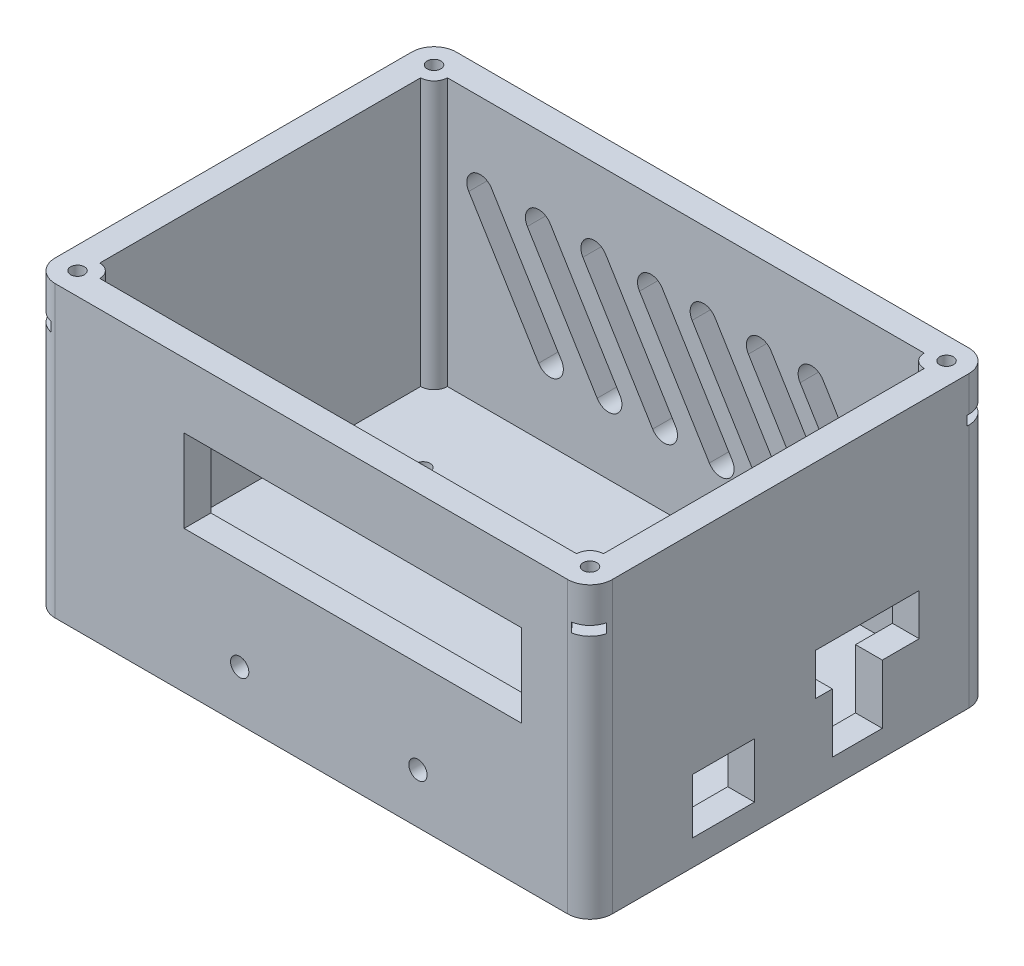
from build123d import *

# Parameters (mm, degrees)
SKETCH1_W           = 125
SKETCH1_H           = 90
BOSS_EXTRUDE1_DEPTH = 5
SKETCH2_W           = 125
SKETCH2_H           = 90
SKETCH2_W_2         = 113
SKETCH2_H_2         = 78
EXTRUDE_THIN1_DEPTH = 60
FILLET1_R           = 5
CUT_EXTRUDE12_REACH = 125.237
SKETCH17_R          = 2.05
CUT_EXTRUDE13_DEPTH = 3
CUT_EXTRUDE15_REACH = 129.402
SKETCH14_W          = 75.736486469
SKETCH14_H          = 18.550578115
SKETCH20_R          = 3
BOSS_EXTRUDE2_DEPTH = 60
SKETCH21_R          = 1.55
CUT_EXTRUDE16_DEPTH = 15
CUT_EXTRUDE17_DEPTH = 2.1
CUT_EXTRUDE18_REACH = 129.402
CUT_EXTRUDE19_REACH = 149.902
SKETCH26_W          = 13.905528105
SKETCH26_H          = 12.333109577
CUT_EXTRUDE20_REACH = 99.628
SKETCH27_R          = 1.5875


with BuildPart() as part:
    # Sketch1 → Boss-Extrude1 (new body)
    with BuildSketch(Plane(origin=(0, 0, 0), x_dir=(1, 0, 0), z_dir=(0, 1, 0))):
        Rectangle(SKETCH1_W, SKETCH1_H)
    extrude(amount=BOSS_EXTRUDE1_DEPTH)

    # Sketch2 → Extrude-Thin1 (add)
    with BuildSketch(Plane(origin=(0, 5, 0), x_dir=(1, 0, 0), z_dir=(0, 1, 0))):
        Rectangle(SKETCH2_W, SKETCH2_H)
        Rectangle(SKETCH2_W_2, SKETCH2_H_2, mode=Mode.SUBTRACT)
    extrude(amount=EXTRUDE_THIN1_DEPTH)

    # Fillet1
    fillet1_edges = [part.edges().sort_by_distance(p)[0] for p in [
        (-62.5, 32.5, -45),
        (62.5, 32.5, -45),
        (62.5, 32.5, 45),
        (-62.5, 32.5, 45),
    ]]
    fillet(fillet1_edges, radius=FILLET1_R)

    # Sketch17 → Cut-Extrude12 (cut, up to next)
    with BuildSketch(Plane(origin=(0, 0, 39), x_dir=(-1, 0, 0), z_dir=(0, 0, -1)), mode=Mode.PRIVATE) as cut_extrude12_sk1:
        with Locations((-23.894791756, 11.205792227)):
            Circle(SKETCH17_R)
    cut_extrude12_tool1 = extrude(cut_extrude12_sk1.sketch, amount=-CUT_EXTRUDE12_REACH, mode=Mode.PRIVATE) & part.part
    # Sketch17 → Cut-Extrude12 (cut, up to next)
    with BuildSketch(Plane(origin=(0, 0, 39), x_dir=(-1, 0, 0), z_dir=(0, 0, -1)), mode=Mode.PRIVATE) as cut_extrude12_sk2:
        with Locations((16.105208244, 11.205792227)):
            Circle(SKETCH17_R)
    cut_extrude12_tool2 = extrude(cut_extrude12_sk2.sketch, amount=-CUT_EXTRUDE12_REACH, mode=Mode.PRIVATE) & part.part
    add(cut_extrude12_tool1.solids().sort_by_distance((23.894792, 11.205792, 39))[0], mode=Mode.SUBTRACT)
    add(cut_extrude12_tool2.solids().sort_by_distance((-16.105208, 11.205792, 39))[0], mode=Mode.SUBTRACT)

    # Sketch18 → Cut-Extrude13 (cut)
    with BuildSketch(Plane(origin=(0, 0, 39), x_dir=(-1, 0, 0), z_dir=(0, 0, -1))):
        Polygon((-21.92132986, 7.547179355), (-19.739609119, 11.085553926), (-21.713071015, 14.744166798), (-25.868253652, 14.864405099), (-28.049974394, 11.326030527), (-26.076512498, 7.667417656), align=None)
        Polygon((18.07867014, 7.547179355), (20.260390881, 11.085553926), (18.286928985, 14.744166798), (14.131746348, 14.864405099), (11.950025606, 11.326030527), (13.923487502, 7.667417656), align=None)
    extrude(amount=-CUT_EXTRUDE13_DEPTH, mode=Mode.SUBTRACT)

    # Sketch14 → Cut-Extrude15 (cut, up to next)
    with BuildSketch(Plane.XY.offset(45), mode=Mode.PRIVATE) as cut_extrude15_sk1:
        with Locations((9.294573428, 41.162886515)):
            Rectangle(SKETCH14_W, SKETCH14_H)
    cut_extrude15_tool1 = extrude(cut_extrude15_sk1.sketch, amount=-CUT_EXTRUDE15_REACH, mode=Mode.PRIVATE) & part.part
    add(cut_extrude15_tool1.solids().sort_by_distance((9.294573, 41.162887, 45))[0], mode=Mode.SUBTRACT)

    # Sketch20 → Boss-Extrude2 (add)
    with BuildSketch(Plane(origin=(0, 5, 0), x_dir=(1, 0, 0), z_dir=(0, 1, 0))):
        with Locations((-56.5, -39)):
            Circle(SKETCH20_R)
        with Locations((-56.5, 39)):
            Circle(SKETCH20_R)
        with Locations((56.5, 39)):
            Circle(SKETCH20_R)
        with Locations((56.5, -39)):
            Circle(SKETCH20_R)
    extrude(amount=BOSS_EXTRUDE2_DEPTH)

    # Sketch21 → Cut-Extrude16 (cut)
    with BuildSketch(Plane(origin=(0, 65, 0), x_dir=(1, 0, 0), z_dir=(0, 1, 0))):
        with Locations(Location((-57.5, -40, 0), (0, 0, 270))):
            Circle(SKETCH21_R)
        with Locations(Location((-57.5, 40, 0), (0, 0, 270))):
            Circle(SKETCH21_R)
        with Locations(Location((57.5, 40, 0), (0, 0, 270))):
            Circle(SKETCH21_R)
        with Locations(Location((57.5, -40, 0), (0, 0, 270))):
            Circle(SKETCH21_R)
    extrude(amount=-CUT_EXTRUDE16_DEPTH, mode=Mode.SUBTRACT)

    # Sketch22 → Cut-Extrude17 (cut)
    with BuildSketch(Plane(origin=(0, 55, 0), x_dir=(1, 0, 0), z_dir=(0, 1, 0))):
        Polygon((-56.858335649, 43.168848402), (-60.369838633, 46.269790836), (-64.01667189, 42.140121829), (-60.565135392, 38.971273428), (-58.141664351, 36.831151598), (-55.076528959, 37.859878171), (-54.434864608, 41.028726572), align=None)
        Polygon((57.5, 43.233161507), (54.7, 41.616580754), (54.7, 38.383419246), (57.5, 36.766838493), (60.3, 38.383419246), (64.375727021, 40.73252086), (61.573986103, 45.585278481), align=None)
        Polygon((60.65032729, -39.272833374), (58.445418874, -36.908153224), (55.295091585, -37.63531985), (54.34967271, -40.727166626), (56.554581126, -43.091846776), (59.704908415, -46.470452598), (63.774744064, -42.675599045), align=None)
        Polygon((-54.378247252, -40.841423267), (-55.210429701, -37.71719445), (-58.332182449, -36.875771182), (-60.621752748, -39.158576733), (-64.278002246, -42.804023501), (-60.369838633, -46.723768365), (-56.667817551, -43.124228818), align=None)
    extrude(amount=CUT_EXTRUDE17_DEPTH, mode=Mode.SUBTRACT)

    # Sketch23 → Cut-Extrude18 (cut, up to next)
    with BuildSketch(Plane(origin=(0, 0, -45), x_dir=(-1, 0, 0), z_dir=(0, 0, -1)), mode=Mode.PRIVATE) as cut_extrude18_sk1:
        with BuildLine():
            Line((-25.648371423, 45.311645428), (-41.315651552, 19.761127033))
            ThreePointArc((-41.315651552, 19.761127033), (-45.441346582, 18.771864422), (-46.430609193, 22.897559452))
            Line((-46.430609193, 22.897559452), (-30.763329065, 48.448077847))
            ThreePointArc((-30.763329065, 48.448077847), (-26.637634034, 49.437340458), (-25.648371423, 45.311645428))
        make_face()
    cut_extrude18_tool1 = extrude(cut_extrude18_sk1.sketch, amount=-CUT_EXTRUDE18_REACH, mode=Mode.PRIVATE) & part.part
    # Sketch23 → Cut-Extrude18 (cut, up to next)
    with BuildSketch(Plane(origin=(0, 0, -45), x_dir=(-1, 0, 0), z_dir=(0, 0, -1)), mode=Mode.PRIVATE) as cut_extrude18_sk2:
        with BuildLine():
            Line((-14.037874604, 45.074791856), (-29.705154732, 19.524273462))
            ThreePointArc((-29.705154732, 19.524273462), (-33.830849763, 18.53501085), (-34.820112374, 22.660705881))
            Line((-34.820112374, 22.660705881), (-19.152832246, 48.211224276))
            ThreePointArc((-19.152832246, 48.211224276), (-15.027137215, 49.200486887), (-14.037874604, 45.074791856))
        make_face()
    cut_extrude18_tool2 = extrude(cut_extrude18_sk2.sketch, amount=-CUT_EXTRUDE18_REACH, mode=Mode.PRIVATE) & part.part
    # Sketch23 → Cut-Extrude18 (cut, up to next)
    with BuildSketch(Plane(origin=(0, 0, -45), x_dir=(-1, 0, 0), z_dir=(0, 0, -1)), mode=Mode.PRIVATE) as cut_extrude18_sk3:
        with BuildLine():
            Line((-1.409471357, 45.311645428), (-17.076751485, 19.761127033))
            ThreePointArc((-17.076751485, 19.761127033), (-21.202446516, 18.771864422), (-22.191709127, 22.897559452))
            Line((-22.191709127, 22.897559452), (-6.524428999, 48.448077847))
            ThreePointArc((-6.524428999, 48.448077847), (-2.398733968, 49.437340458), (-1.409471357, 45.311645428))
        make_face()
    cut_extrude18_tool3 = extrude(cut_extrude18_sk3.sketch, amount=-CUT_EXTRUDE18_REACH, mode=Mode.PRIVATE) & part.part
    # Sketch23 → Cut-Extrude18 (cut, up to next)
    with BuildSketch(Plane(origin=(0, 0, -45), x_dir=(-1, 0, 0), z_dir=(0, 0, -1)), mode=Mode.PRIVATE) as cut_extrude18_sk4:
        with BuildLine():
            Line((10.391118885, 45.074791856), (-5.276161243, 19.524273462))
            ThreePointArc((-5.276161243, 19.524273462), (-9.401856274, 18.53501085), (-10.391118885, 22.660705881))
            Line((-10.391118885, 22.660705881), (5.276161243, 48.211224276))
            ThreePointArc((5.276161243, 48.211224276), (9.401856274, 49.200486887), (10.391118885, 45.074791856))
        make_face()
    cut_extrude18_tool4 = extrude(cut_extrude18_sk4.sketch, amount=-CUT_EXTRUDE18_REACH, mode=Mode.PRIVATE) & part.part
    # Sketch23 → Cut-Extrude18 (cut, up to next)
    with BuildSketch(Plane(origin=(0, 0, -45), x_dir=(-1, 0, 0), z_dir=(0, 0, -1)), mode=Mode.PRIVATE) as cut_extrude18_sk5:
        with BuildLine():
            Line((23.099177091, 45.311645428), (7.431896962, 19.761127033))
            ThreePointArc((7.431896962, 19.761127033), (3.306201932, 18.771864422), (2.31693932, 22.897559452))
            Line((2.31693932, 22.897559452), (17.984219449, 48.448077847))
            ThreePointArc((17.984219449, 48.448077847), (22.109914479, 49.437340458), (23.099177091, 45.311645428))
        make_face()
    cut_extrude18_tool5 = extrude(cut_extrude18_sk5.sketch, amount=-CUT_EXTRUDE18_REACH, mode=Mode.PRIVATE) & part.part
    # Sketch23 → Cut-Extrude18 (cut, up to next)
    with BuildSketch(Plane(origin=(0, 0, -45), x_dir=(-1, 0, 0), z_dir=(0, 0, -1)), mode=Mode.PRIVATE) as cut_extrude18_sk6:
        with BuildLine():
            Line((35.561378032, 45.074791856), (19.894097903, 19.524273462))
            ThreePointArc((19.894097903, 19.524273462), (15.768402872, 18.53501085), (14.779140261, 22.660705881))
            Line((14.779140261, 22.660705881), (30.44642039, 48.211224276))
            ThreePointArc((30.44642039, 48.211224276), (34.57211542, 49.200486887), (35.561378032, 45.074791856))
        make_face()
    cut_extrude18_tool6 = extrude(cut_extrude18_sk6.sketch, amount=-CUT_EXTRUDE18_REACH, mode=Mode.PRIVATE) & part.part
    # Sketch23 → Cut-Extrude18 (cut, up to next)
    with BuildSketch(Plane(origin=(0, 0, -45), x_dir=(-1, 0, 0), z_dir=(0, 0, -1)), mode=Mode.PRIVATE) as cut_extrude18_sk7:
        with BuildLine():
            Line((48.702197111, 45.311645428), (33.034916983, 19.761127033))
            ThreePointArc((33.034916983, 19.761127033), (28.909221952, 18.771864422), (27.919959341, 22.897559452))
            Line((27.919959341, 22.897559452), (43.587239469, 48.448077847))
            ThreePointArc((43.587239469, 48.448077847), (47.7129345, 49.437340458), (48.702197111, 45.311645428))
        make_face()
    cut_extrude18_tool7 = extrude(cut_extrude18_sk7.sketch, amount=-CUT_EXTRUDE18_REACH, mode=Mode.PRIVATE) & part.part
    add(cut_extrude18_tool1.solids().sort_by_distance((36.03949, 34.104602, -45))[0], mode=Mode.SUBTRACT)
    add(cut_extrude18_tool2.solids().sort_by_distance((24.428993, 33.867749, -45))[0], mode=Mode.SUBTRACT)
    add(cut_extrude18_tool3.solids().sort_by_distance((11.80059, 34.104602, -45))[0], mode=Mode.SUBTRACT)
    add(cut_extrude18_tool4.solids().sort_by_distance((0, 33.867749, -45))[0], mode=Mode.SUBTRACT)
    add(cut_extrude18_tool5.solids().sort_by_distance((-12.708058, 34.104602, -45))[0], mode=Mode.SUBTRACT)
    add(cut_extrude18_tool6.solids().sort_by_distance((-25.170259, 33.867749, -45))[0], mode=Mode.SUBTRACT)
    add(cut_extrude18_tool7.solids().sort_by_distance((-38.311078, 34.104602, -45))[0], mode=Mode.SUBTRACT)

    # Sketch26 → Cut-Extrude19 (cut, up to next)
    with BuildSketch(Plane(origin=(62.5, 0, 0), x_dir=(0, 0, -1), z_dir=(1, 0, 0)), mode=Mode.PRIVATE) as cut_extrude19_sk1:
        Polygon((5.578920685, 19.047391922), (9.382102995, 19.047391922), (9.382102995, 5.775643938), (20.587908017, 5.775643938), (20.587908017, 19.047391922), (28.873412337, 19.047391922), (28.873412337, 28.419519758), (5.578920685, 28.419519758), align=None)
    cut_extrude19_tool1 = extrude(cut_extrude19_sk1.sketch, amount=-CUT_EXTRUDE19_REACH, mode=Mode.PRIVATE) & part.part
    # Sketch26 → Cut-Extrude19 (cut, up to next)
    with BuildSketch(Plane(origin=(62.5, 0, 0), x_dir=(0, 0, -1), z_dir=(1, 0, 0)), mode=Mode.PRIVATE) as cut_extrude19_sk2:
        with Locations((-15.040875866, 11.942198726)):
            Rectangle(SKETCH26_W, SKETCH26_H)
    cut_extrude19_tool2 = extrude(cut_extrude19_sk2.sketch, amount=-CUT_EXTRUDE19_REACH, mode=Mode.PRIVATE) & part.part
    add(cut_extrude19_tool1.solids().sort_by_distance((62.5, 19.145924, -16.318071))[0], mode=Mode.SUBTRACT)
    add(cut_extrude19_tool2.solids().sort_by_distance((62.5, 11.942199, 15.040876))[0], mode=Mode.SUBTRACT)

    # Sketch27 → Cut-Extrude20 (cut, up to next)
    with BuildSketch(Plane(origin=(0, 5, 0), x_dir=(1, 0, 0), z_dir=(0, 1, 0)), mode=Mode.PRIVATE) as cut_extrude20_sk1:
        with Locations(Location((42.046142412, 20.540310896, 0), (0, 0, 270))):
            Circle(SKETCH27_R)
    cut_extrude20_tool1 = extrude(cut_extrude20_sk1.sketch, amount=-CUT_EXTRUDE20_REACH, mode=Mode.PRIVATE) & part.part
    # Sketch27 → Cut-Extrude20 (cut, up to next)
    with BuildSketch(Plane(origin=(0, 5, 0), x_dir=(1, 0, 0), z_dir=(0, 1, 0)), mode=Mode.PRIVATE) as cut_extrude20_sk2:
        with Locations(Location((40.776142412, -27.719689104, 0), (0, 0, 270))):
            Circle(SKETCH27_R)
    cut_extrude20_tool2 = extrude(cut_extrude20_sk2.sketch, amount=-CUT_EXTRUDE20_REACH, mode=Mode.PRIVATE) & part.part
    # Sketch27 → Cut-Extrude20 (cut, up to next)
    with BuildSketch(Plane(origin=(0, 5, 0), x_dir=(1, 0, 0), z_dir=(0, 1, 0)), mode=Mode.PRIVATE) as cut_extrude20_sk3:
        with Locations(Location((-40.503857588, 20.540310896, 0), (0, 0, 270))):
            Circle(SKETCH27_R)
    cut_extrude20_tool3 = extrude(cut_extrude20_sk3.sketch, amount=-CUT_EXTRUDE20_REACH, mode=Mode.PRIVATE) & part.part
    # Sketch27 → Cut-Extrude20 (cut, up to next)
    with BuildSketch(Plane(origin=(0, 5, 0), x_dir=(1, 0, 0), z_dir=(0, 1, 0)), mode=Mode.PRIVATE) as cut_extrude20_sk4:
        with Locations(Location((-34.153857588, -27.719689104, 0), (0, 0, 270))):
            Circle(SKETCH27_R)
    cut_extrude20_tool4 = extrude(cut_extrude20_sk4.sketch, amount=-CUT_EXTRUDE20_REACH, mode=Mode.PRIVATE) & part.part
    add(cut_extrude20_tool1.solids().sort_by_distance((42.046142, 5, -20.540311))[0], mode=Mode.SUBTRACT)
    add(cut_extrude20_tool2.solids().sort_by_distance((40.776142, 5, 27.719689))[0], mode=Mode.SUBTRACT)
    add(cut_extrude20_tool3.solids().sort_by_distance((-40.503858, 5, -20.540311))[0], mode=Mode.SUBTRACT)
    add(cut_extrude20_tool4.solids().sort_by_distance((-34.153858, 5, 27.719689))[0], mode=Mode.SUBTRACT)


solid = part.part
